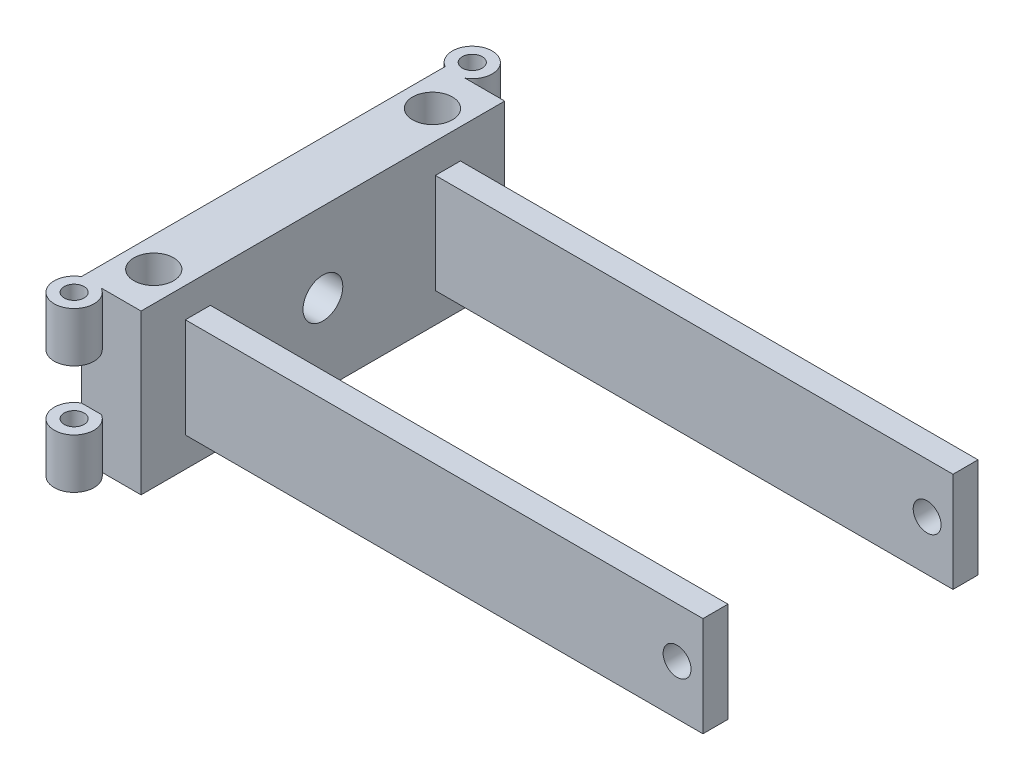
from build123d import *

# Parameters (mm, degrees)
SKETCH2_R               = 2.5
BOSS_EXTRUDE2_DEPTH     = 20
SKETCH6_W               = 9.981195927
SKETCH6_H               = 91.339745962
BOSS_EXTRUDE3_DEPTH     = 40
CUT_EXTRUDE2_DEPTH      = 69.735902352
CUT_EXTRUDE2_DEPTH_BACK = 69.735902352
SKETCH4_R               = 5
CUT_EXTRUDE1_DEPTH      = 60.368546151
CUT_EXTRUDE1_DEPTH_BACK = 60.368546151
SKETCH3_R               = 5
SKETCH3_W               = 9.330127019
SKETCH3_H               = 15
SKETCH7_W               = 6.280786139
SKETCH7_H               = 25.065781514
BOSS_EXTRUDE4_DEPTH     = 130
CUT_EXTRUDE4_DEPTH      = 165.095031026
CUT_EXTRUDE4_DEPTH_BACK = 165.095031026
SKETCH8_R               = 3.5


with BuildPart() as part:
    # Sketch2 → Boss-Extrude2 (new, symmetric)
    with BuildSketch(Plane(origin=(0, 0, 0), x_dir=(1, 0, 0), z_dir=(0, 1, 0))):
        with BuildLine():
            Line((-5, -45.669872981), (-5, 45.669872981))
            ThreePointArc((-5, 45.669872981), (-2.5, 55), (0, 45.669872981))
            Line((0, 45.669872981), (0, -45.669872981))
            ThreePointArc((0, -45.669872981), (-2.5, -55), (-5, -45.669872981))
        make_face()
        with Locations(Location((-2.5, 50, 0), (0, 0, 270))):
            Circle(SKETCH2_R, mode=Mode.SUBTRACT)
        with Locations(Location((-2.5, -50, 0), (0, 0, 270))):
            Circle(SKETCH2_R, mode=Mode.SUBTRACT)
    extrude(amount=BOSS_EXTRUDE2_DEPTH, both=True)

    # Sketch6 → Boss-Extrude3 (add)
    with BuildSketch(Plane.XZ.offset(20)):
        with Locations((4.990597963, 0)):
            Rectangle(SKETCH6_W, SKETCH6_H)
    extrude(amount=-BOSS_EXTRUDE3_DEPTH)

    # Sketch4 → Cut-Extrude2 (cut, two sides: drawn at the far end of the back side and taken through both)
    with BuildSketch(Plane(origin=(0, 20, 0), x_dir=(1, 0, 0), z_dir=(0, 1, 0)).offset(-CUT_EXTRUDE2_DEPTH_BACK)):
        with Locations(Location((2.5, 35, 0), (0, 0, 270))):
            Circle(SKETCH4_R)
        with Locations(Location((2.5, -35, 0), (0, 0, 270))):
            Circle(SKETCH4_R)
    extrude(amount=CUT_EXTRUDE2_DEPTH + CUT_EXTRUDE2_DEPTH_BACK, mode=Mode.SUBTRACT)

    # Sketch3 → Cut-Extrude1 (cut, two sides: drawn at the far end of the back side and taken through both)
    with BuildSketch(Plane(origin=(0, 0, 0), x_dir=(0, 0, -1), z_dir=(1, 0, 0)).offset(-CUT_EXTRUDE1_DEPTH_BACK)):
        Circle(SKETCH3_R)
        with Locations((50.33493649, 0)):
            Rectangle(SKETCH3_W, SKETCH3_H)
        with Locations((-50.33493649, 0)):
            Rectangle(SKETCH3_W, SKETCH3_H)
    extrude(amount=CUT_EXTRUDE1_DEPTH + CUT_EXTRUDE1_DEPTH_BACK, mode=Mode.SUBTRACT)

    # Sketch7 → Boss-Extrude4 (add)
    with BuildSketch(Plane(origin=(9.981195927, 0, 0), x_dir=(0, 0, -1), z_dir=(1, 0, 0))):
        with Locations((-31.401692569, 0)):
            Rectangle(SKETCH7_W, SKETCH7_H)
        with Locations((31.401692569, 0)):
            Rectangle(SKETCH7_W, SKETCH7_H)
    extrude(amount=BOSS_EXTRUDE4_DEPTH)

    # Sketch8 → Cut-Extrude4 (cut, two sides: drawn at the far end of the back side and taken through both)
    with BuildSketch(Plane(origin=(0, 0, 28.2612995), x_dir=(-1, 0, 0), z_dir=(0, 0, -1)).offset(-CUT_EXTRUDE4_DEPTH_BACK)):
        with Locations((-133.481195927, 0)):
            Circle(SKETCH8_R)
    extrude(amount=CUT_EXTRUDE4_DEPTH + CUT_EXTRUDE4_DEPTH_BACK, mode=Mode.SUBTRACT)


solid = part.part
